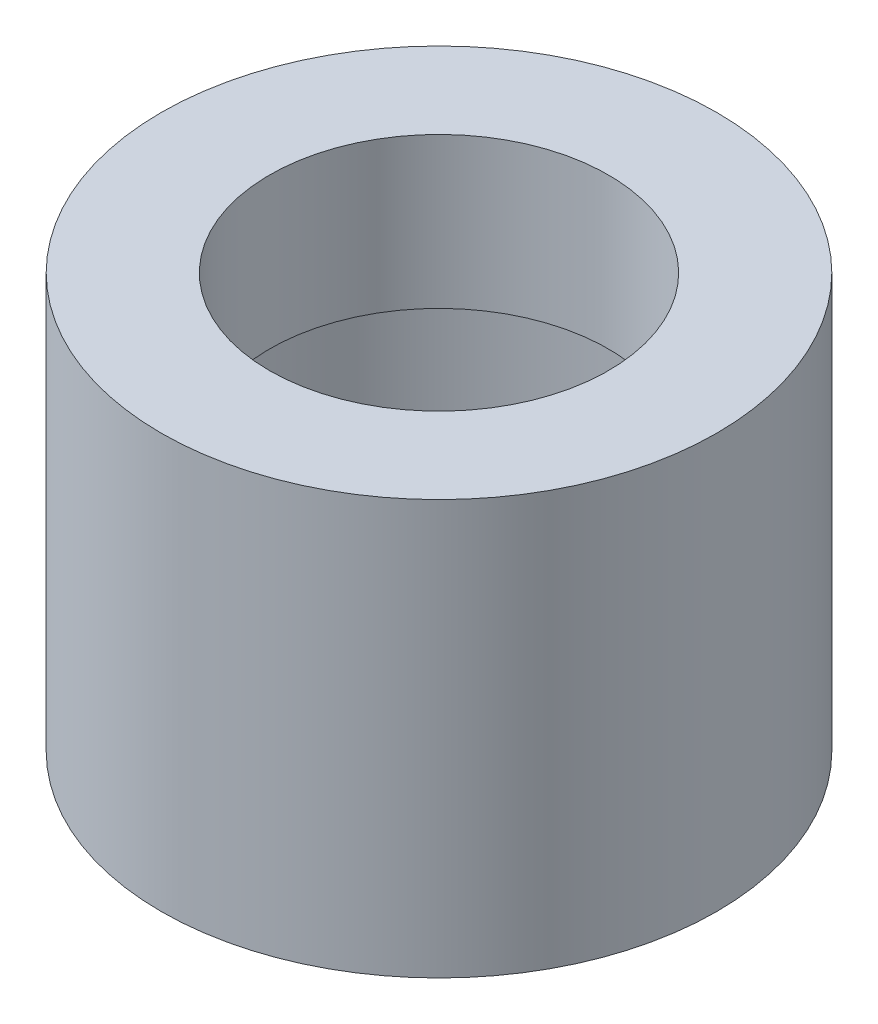
from build123d import *

# Parameters (mm, degrees)
SKETCH1_R           = 14.75
SKETCH1_R_2         = 13
BOSS_EXTRUDE1_DEPTH = 11
BOSS_EXTRUDE2_START = -8
SKETCH2_R           = 13
SKETCH2_R_2         = 9
BOSS_EXTRUDE2_DEPTH = 8


with BuildPart() as part:
    # Sketch1 → Boss-Extrude1 (new, symmetric)
    with BuildSketch(Plane(origin=(0, 0, 0), x_dir=(1, 0, 0), z_dir=(0, 1, 0))):
        with Locations(Location((0, 0, 0), (0, 0, 270))):
            Circle(SKETCH1_R)
        with Locations(Location((0, 0, 0), (0, 0, 270))):
            Circle(SKETCH1_R_2, mode=Mode.SUBTRACT)
    extrude(amount=BOSS_EXTRUDE1_DEPTH, both=True)

    # Sketch2 → Boss-Extrude2 (add)
    with BuildSketch(Plane(origin=(0, 11, 0), x_dir=(1, 0, 0), z_dir=(0, 1, 0)).offset(BOSS_EXTRUDE2_START)):
        with Locations(Location((0, 0, 0), (0, 0, 270))):
            Circle(SKETCH2_R)
        with Locations(Location((0, 0, 0), (0, 0, 270))):
            Circle(SKETCH2_R_2, mode=Mode.SUBTRACT)
    extrude(amount=BOSS_EXTRUDE2_DEPTH)


solid = part.part
